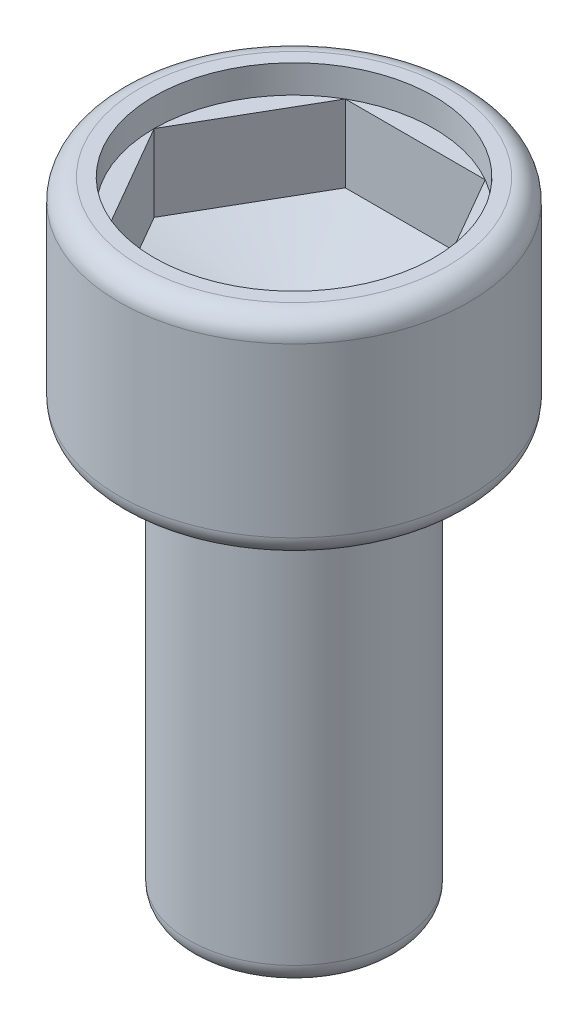
from build123d import *

# Parameters (mm, degrees)
SKETCH1_R           = 2.5
BOSS_EXTRUDE1_DEPTH = 3
CUT_EXTRUDE1_DEPTH  = 1.5
CUT_EXTRUDE2_START  = 1.5
SKETCH5_R           = 2
CUT_EXTRUDE2_DEPTH  = 0.4
SKETCH7_R           = 1.5
BOSS_EXTRUDE2_DEPTH = 6
FILLET1_R           = 0.3
FILLET2_R           = 0.3


with BuildPart() as part:
    # Sketch1 → Boss-Extrude1 (new body)
    with BuildSketch(Plane(origin=(0, 0, 0), x_dir=(1, 0, 0), z_dir=(0, 1, 0))):
        with Locations(Location((0, 0, 0), (0, 0, 270))):
            Circle(SKETCH1_R)
    extrude(amount=BOSS_EXTRUDE1_DEPTH)

    # Sketch2 → Cut-Extrude1 (cut)
    with BuildSketch(Plane(origin=(0, 3, 0), x_dir=(1, 0, 0), z_dir=(0, 1, 0))):
        Polygon((2, 0), (1, 1.732050808), (-1, 1.732050808), (-2, 0), (-1, -1.732050808), (1, -1.732050808), align=None)
    extrude(amount=-CUT_EXTRUDE1_DEPTH, mode=Mode.SUBTRACT)

    # Sketch5 → Cut-Extrude2 (cut)
    with BuildSketch(Plane(origin=(0, 1.5, 0), x_dir=(1, 0, 0), z_dir=(0, 1, 0)).offset(CUT_EXTRUDE2_START)):
        with Locations(Location((0, 0, 0), (0, 0, 270))):
            Circle(SKETCH5_R)
    extrude(amount=-CUT_EXTRUDE2_DEPTH, mode=Mode.SUBTRACT)

    # Cut-Extrude3 cone 1 section (through the dimple's axis) → Cut-Extrude3 (revolve, cut)
    with BuildSketch(Plane(origin=(0, 1.5, 0), x_dir=(0, 0, 1), z_dir=(1, 0, 0))):
        Polygon((0, 0), (2, 0), (0, 0.498656006), align=None)
    revolve(axis=Axis((0, 1.5, 0), (0, -1, 0)), mode=Mode.SUBTRACT)

    # Sketch7 → Boss-Extrude2 (add)
    with BuildSketch(Plane.XZ):
        with Locations(Location((0, 0, 0), (0, 0, 270))):
            Circle(SKETCH7_R)
    extrude(amount=BOSS_EXTRUDE2_DEPTH)

    # Fillet1
    fillet1_edges = [part.edges().sort_by_distance(p)[0] for p in [
        (0, 0, -2.5),
        (0, 3, -2.5),
    ]]
    fillet(fillet1_edges, radius=FILLET1_R)

    # Fillet2
    fillet2_edges = [part.edges().sort_by_distance(p)[0] for p in [
        (0, -6, 1.5),
    ]]
    fillet(fillet2_edges, radius=FILLET2_R)


solid = part.part
